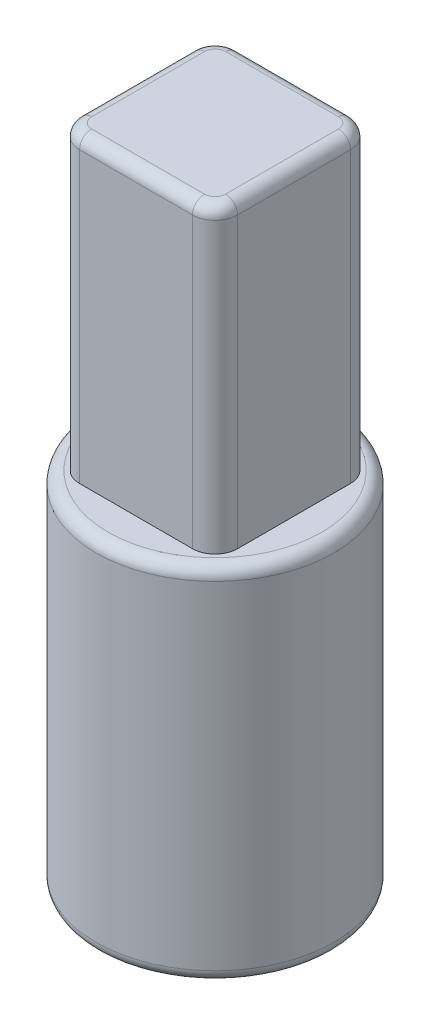
from build123d import *

# Parameters (mm, degrees)
SKETCH1_R           = 3.95
BOSS_EXTRUDE1_DEPTH = 12
SKETCH2_W           = 5.25
SKETCH2_H           = 5.25
BOSS_EXTRUDE2_DEPTH = 10
CUT_EXTRUDE1_DEPTH  = 11
FILLET1_R           = 0.75
FILLET2_R           = 0.4


with BuildPart() as part:
    # Sketch1 → Boss-Extrude1 (new body)
    with BuildSketch(Plane(origin=(0, 0, 0), x_dir=(1, 0, 0), z_dir=(0, 1, 0))):
        with Locations(Location((0, 0, 0), (0, 0, 270))):
            Circle(SKETCH1_R)
    extrude(amount=BOSS_EXTRUDE1_DEPTH)

    # Sketch2 → Boss-Extrude2 (add)
    with BuildSketch(Plane(origin=(0, 12, 0), x_dir=(1, 0, 0), z_dir=(0, 1, 0))):
        Rectangle(SKETCH2_W, SKETCH2_H)
    extrude(amount=BOSS_EXTRUDE2_DEPTH)

    # Sketch3 → Cut-Extrude1 (cut)
    with BuildSketch(Plane.XZ):
        with BuildLine():
            Line((1.025, -1.540089283), (-1.025, -1.540089283))
            ThreePointArc((-1.025, -1.540089283), (0, 1.85), (1.025, -1.540089283))
        make_face()
    extrude(amount=-CUT_EXTRUDE1_DEPTH, mode=Mode.SUBTRACT)

    # Fillet1
    fillet1_edges = [part.edges().sort_by_distance(p)[0] for p in [
        (-2.625, 17, -2.625),
        (-2.625, 17, 2.625),
        (2.625, 17, 2.625),
        (2.625, 17, -2.625),
    ]]
    fillet(fillet1_edges, radius=FILLET1_R)

    # Fillet2
    fillet2_edges = [part.edges().sort_by_distance(p)[0] for p in [
        (0, 0, 1.85),
        (0, 0, -1.540089283),
        (0, 0, -3.95),
        (2.625, 22, 0),
        (0, 22, 2.625),
        (-2.625, 22, 0),
        (0, 22, -2.625),
        (-2.405330086, 22, 2.405330086),
        (-2.405330086, 22, -2.405330086),
        (2.405330086, 22, -2.405330086),
        (2.405330086, 22, 2.405330086),
        (0, 12, -3.95),
    ]]
    fillet(fillet2_edges, radius=FILLET2_R)


solid = part.part
